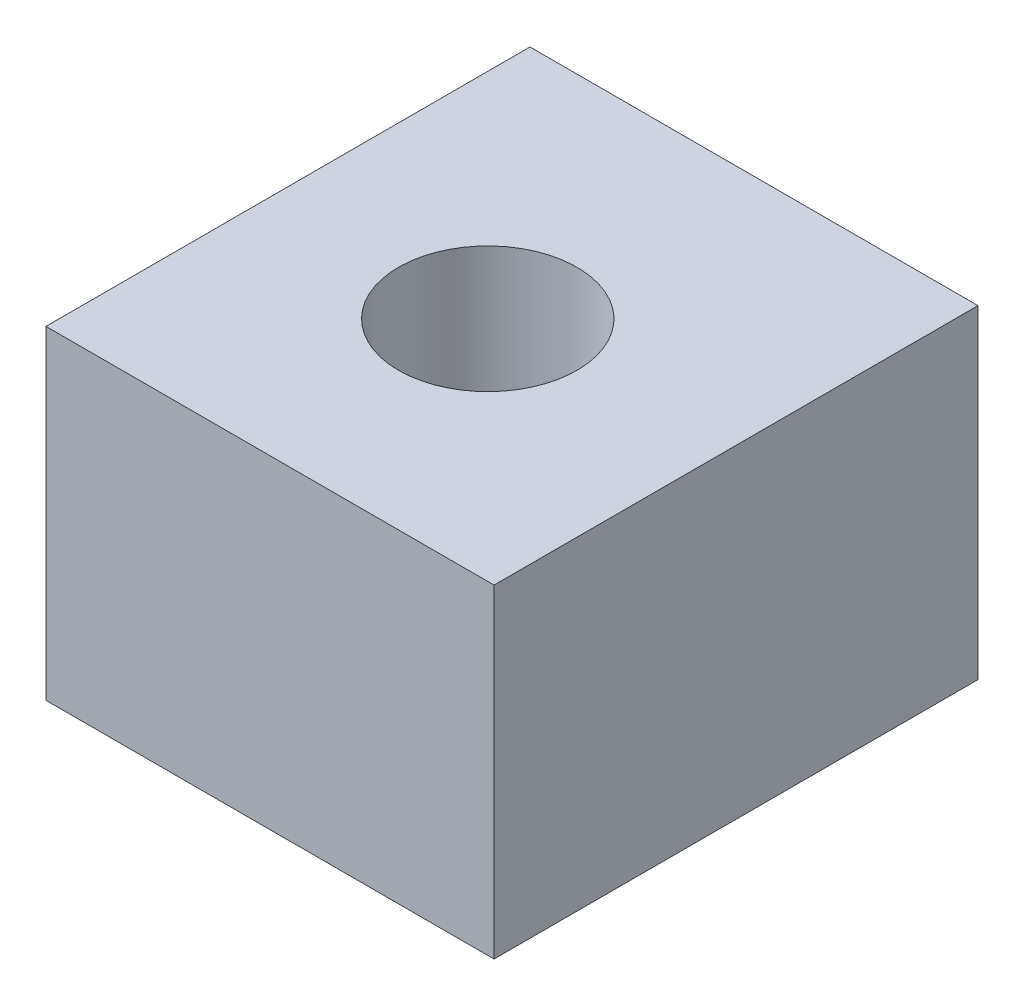
from build123d import *

# Parameters (mm, degrees)
SKETCH1_W           = 86.53244286
SKETCH1_H           = 62.555187021
BOSS_EXTRUDE1_DEPTH = 93.472
SKETCH2_R           = 17.242015653
CUT_EXTRUDE1_DEPTH  = 93.472


with BuildPart() as part:
    # Sketch1 → Boss-Extrude1 (new body)
    with BuildSketch(Plane.XY):
        with Locations((43.26622143, -31.277593511)):
            Rectangle(SKETCH1_W, SKETCH1_H)
    extrude(amount=BOSS_EXTRUDE1_DEPTH)

    # Sketch2 → Cut-Extrude1 (cut)
    with BuildSketch(Plane(origin=(0, 0, 0), x_dir=(1, 0, 0), z_dir=(0, 1, 0))):
        with Locations(Location((41.391901458, -49.541343138, 0), (0, 0, 270))):
            Circle(SKETCH2_R)
    extrude(amount=-CUT_EXTRUDE1_DEPTH, mode=Mode.SUBTRACT)


solid = part.part
